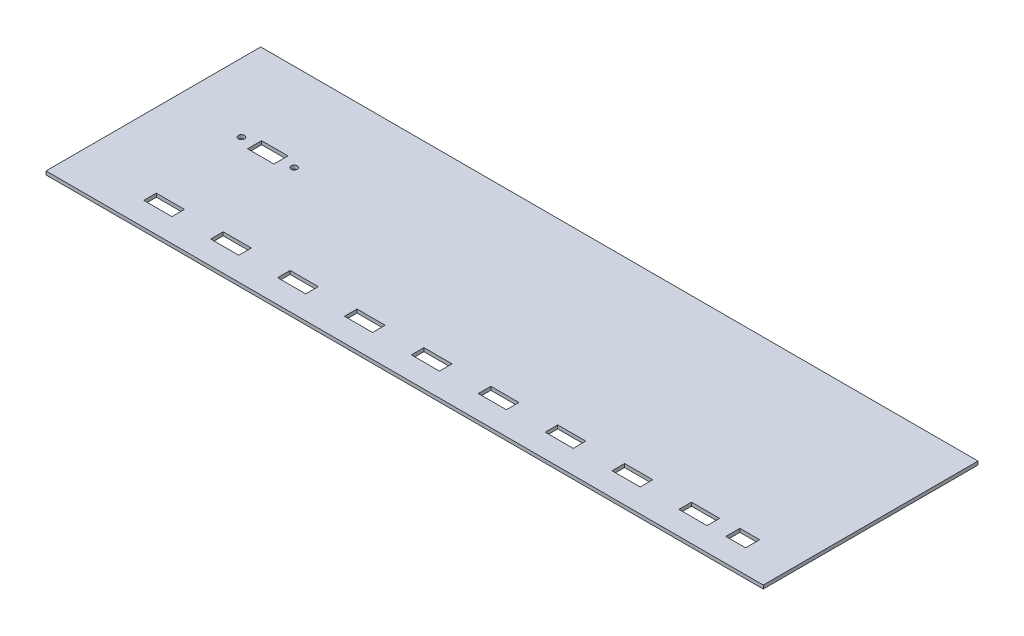
from build123d import *

# Parameters (mm, degrees)
SKETCH1_W           = 408.5
SKETCH1_H           = 122.3
SKETCH1_R           = 1.75
SKETCH1_W_2         = 16
SKETCH1_H_2         = 7.15
SKETCH1_W_3         = 11.25
SKETCH1_H_3         = 8
SKETCH1_W_4         = 15
BOSS_EXTRUDE1_DEPTH = 2


with BuildPart() as part:
    # Sketch1 → Boss-Extrude1 (new body)
    with BuildSketch(Plane(origin=(0, 0, 0), x_dir=(1, 0, 0), z_dir=(0, 1, 0))):
        with Locations((204.25, 61.15)):
            Rectangle(SKETCH1_W, SKETCH1_H)
        with Locations(Location((39, 72.3, 0), (0, 0, 270))):
            Circle(SKETCH1_R, mode=Mode.SUBTRACT)
        with Locations(Location((69, 72.3, 0), (0, 0, 270))):
            Circle(SKETCH1_R, mode=Mode.SUBTRACT)
        with Locations((317.09, 16.875)):
            Rectangle(SKETCH1_W_2, SKETCH1_H_2, mode=Mode.SUBTRACT)
        with Locations((379.5, 17.3)):
            Rectangle(SKETCH1_W_3, SKETCH1_H_3, mode=Mode.SUBTRACT)
        with Locations((355.19, 16.875)):
            Rectangle(SKETCH1_W_2, SKETCH1_H_2, mode=Mode.SUBTRACT)
        with Locations((278.99, 16.875)):
            Rectangle(SKETCH1_W_2, SKETCH1_H_2, mode=Mode.SUBTRACT)
        with Locations((240.89, 16.875)):
            Rectangle(SKETCH1_W_2, SKETCH1_H_2, mode=Mode.SUBTRACT)
        with Locations((202.79, 16.875)):
            Rectangle(SKETCH1_W_2, SKETCH1_H_2, mode=Mode.SUBTRACT)
        with Locations((164.69, 16.875)):
            Rectangle(SKETCH1_W_2, SKETCH1_H_2, mode=Mode.SUBTRACT)
        with Locations((126.59, 16.875)):
            Rectangle(SKETCH1_W_2, SKETCH1_H_2, mode=Mode.SUBTRACT)
        with Locations((88.49, 16.875)):
            Rectangle(SKETCH1_W_2, SKETCH1_H_2, mode=Mode.SUBTRACT)
        with Locations((50.39, 16.875)):
            Rectangle(SKETCH1_W_2, SKETCH1_H_2, mode=Mode.SUBTRACT)
        with Locations((54, 72.3)):
            Rectangle(SKETCH1_W_4, SKETCH1_H_3, mode=Mode.SUBTRACT)
    extrude(amount=BOSS_EXTRUDE1_DEPTH)


solid = part.part
